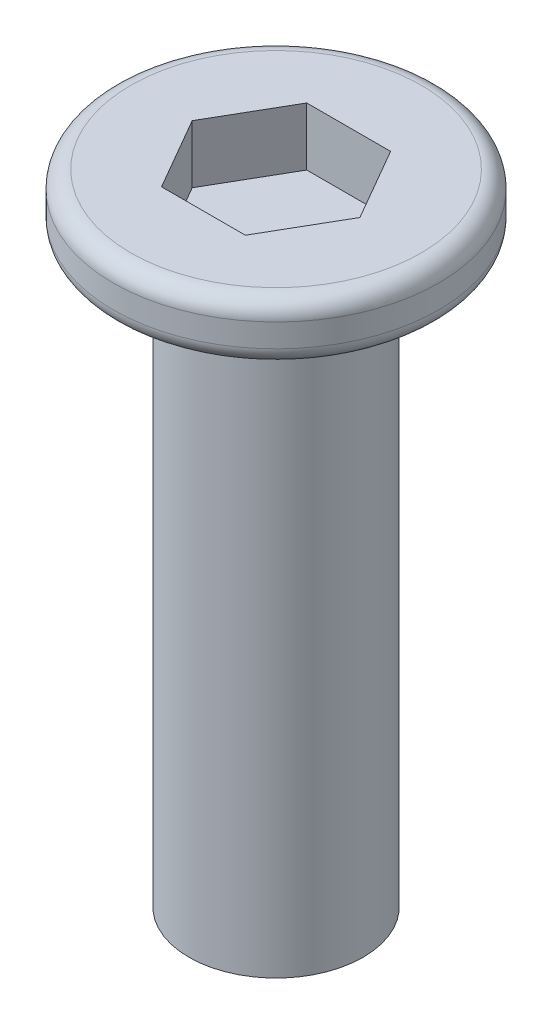
from build123d import *

# Parameters (mm, degrees)
SKETCH_1_R          = 1.5
EXTRUDE_1_DEPTH     = 10
SKETCH_2_R          = 2.8
EXTRUDE_2_DEPTH     = 1
CUT_EXTRUDE_1_DEPTH = 1
FILLET_1_R          = 0.3


with BuildPart() as part:
    # 草图1 → 凸台-拉伸1 (new body)
    with BuildSketch(Plane(origin=(0, 0, 0), x_dir=(1, 0, 0), z_dir=(0, 1, 0))):
        with Locations(Location((0, 0, 0), (0, 0, 270))):
            Circle(SKETCH_1_R)
    extrude(amount=EXTRUDE_1_DEPTH)

    # 草图2 → 凸台-拉伸2 (add)
    with BuildSketch(Plane(origin=(0, 10, 0), x_dir=(1, 0, 0), z_dir=(0, 1, 0))):
        with Locations(Location((0, 0, 0), (0, 0, 270))):
            Circle(SKETCH_2_R)
    extrude(amount=EXTRUDE_2_DEPTH)

    # 草图3 → 切除-拉伸1 (cut)
    with BuildSketch(Plane(origin=(0, 11, 0), x_dir=(1, 0, 0), z_dir=(0, 1, 0))):
        Polygon((-1.443375673, 0), (-0.721687836, -1.25), (0.721687836, -1.25), (1.443375673, 0), (0.721687836, 1.25), (-0.721687836, 1.25), align=None)
    extrude(amount=-CUT_EXTRUDE_1_DEPTH, mode=Mode.SUBTRACT)

    # 圆角1
    fillet_1_edges = [part.edges().sort_by_distance(p)[0] for p in [
        (0, 10, -2.8),
        (0, 11, -2.8),
    ]]
    fillet(fillet_1_edges, radius=FILLET_1_R)


solid = part.part
